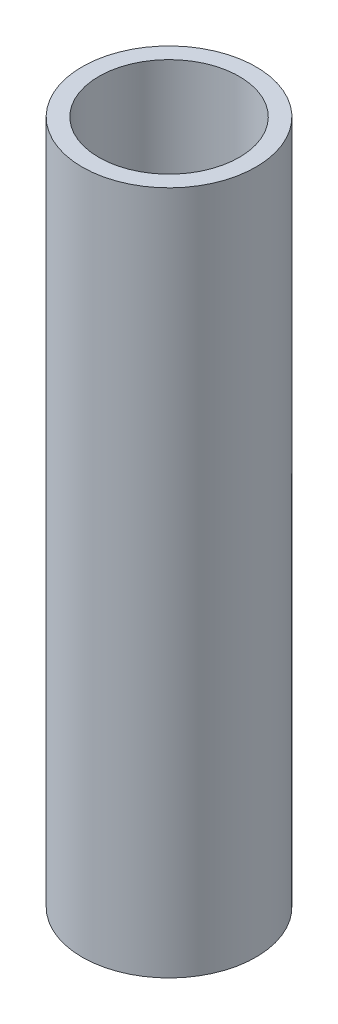
from build123d import *

# Parameters (mm, degrees)
SKETCH1_R           = 3.302
SKETCH1_R_2         = 2.667
BOSS_EXTRUDE1_DEPTH = 26


with BuildPart() as part:
    # Sketch1 → Boss-Extrude1 (new body)
    with BuildSketch(Plane(origin=(0, 0, 0), x_dir=(1, 0, 0), z_dir=(0, 1, 0))):
        with Locations(Location((0, 0, 0), (0, 0, 90))):
            Circle(SKETCH1_R)
        with Locations(Location((0, 0, 0), (0, 0, 90))):
            Circle(SKETCH1_R_2, mode=Mode.SUBTRACT)
    extrude(amount=BOSS_EXTRUDE1_DEPTH)


solid = part.part
